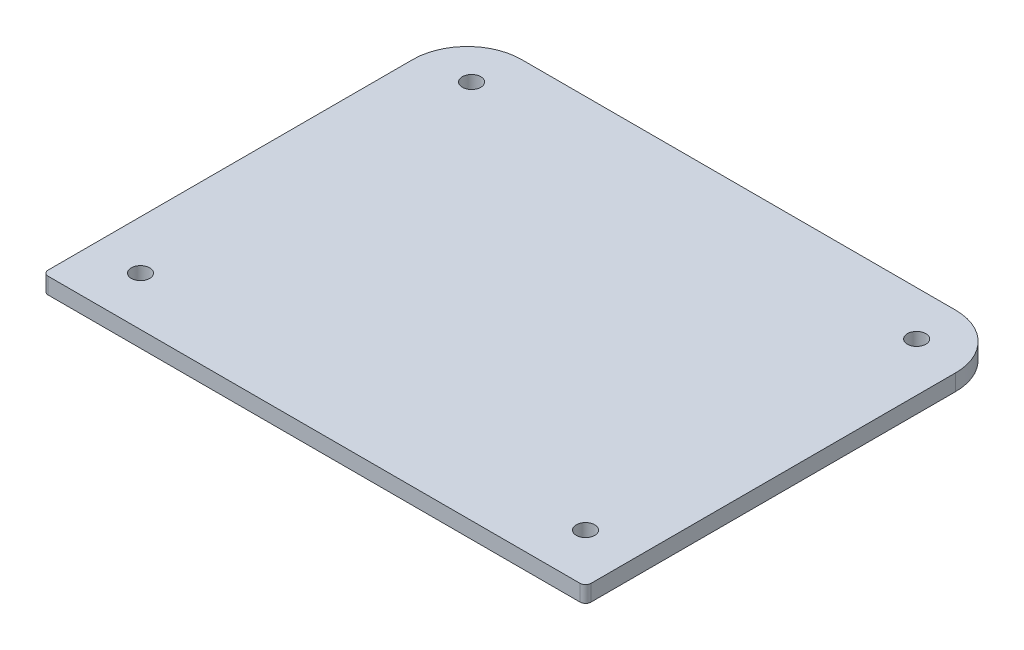
from build123d import *

# Parameters (mm, degrees)
SKETCH1_W           = 100
SKETCH1_H           = 100
BOSS_EXTRUDE1_DEPTH = 3
SKETCH2_R           = 1.7
CUT_EXTRUDE1_DEPTH  = 3
SKETCH6_W           = 100
SKETCH6_H           = 21.808924231
CUT_EXTRUDE2_DEPTH  = 3
FILLET2_R           = 10
FILLET3_R           = 1


with BuildPart() as part:
    # Sketch1 → Boss-Extrude1 (new body)
    with BuildSketch(Plane(origin=(0, 33, 0), x_dir=(1, 0, 0), z_dir=(0, 1, 0))):
        Rectangle(SKETCH1_W, SKETCH1_H)
    extrude(amount=BOSS_EXTRUDE1_DEPTH)

    # Sketch2 → Cut-Extrude1 (cut)
    with BuildSketch(Plane(origin=(0, 36, 0), x_dir=(1, 0, 0), z_dir=(0, 1, 0))):
        with Locations(Location((-41, 20, 0), (0, 0, 270))):
            Circle(SKETCH2_R)
        with Locations(Location((41, 20, 0), (0, 0, 270))):
            Circle(SKETCH2_R)
        with Locations(Location((41, -41, 0), (0, 0, 270))):
            Circle(SKETCH2_R)
        with Locations(Location((-41, -41, 0), (0, 0, 270))):
            Circle(SKETCH2_R)
    extrude(amount=-CUT_EXTRUDE1_DEPTH, mode=Mode.SUBTRACT)

    # Sketch6 → Cut-Extrude2 (cut)
    with BuildSketch(Plane(origin=(0, 36, 0), x_dir=(1, 0, 0), z_dir=(0, 1, 0))):
        with Locations((0, 39.095537885)):
            Rectangle(SKETCH6_W, SKETCH6_H)
    extrude(amount=-CUT_EXTRUDE2_DEPTH, mode=Mode.SUBTRACT)

    # Fillet2
    fillet2_edges = [part.edges().sort_by_distance(p)[0] for p in [
        (-50, 34.5, -28.191075769),
        (50, 34.5, -28.191075769),
    ]]
    fillet(fillet2_edges, radius=FILLET2_R)

    # Fillet3
    fillet3_edges = [part.edges().sort_by_distance(p)[0] for p in [
        (50, 34.5, 50),
        (-50, 34.5, 50),
    ]]
    fillet(fillet3_edges, radius=FILLET3_R)


solid = part.part
